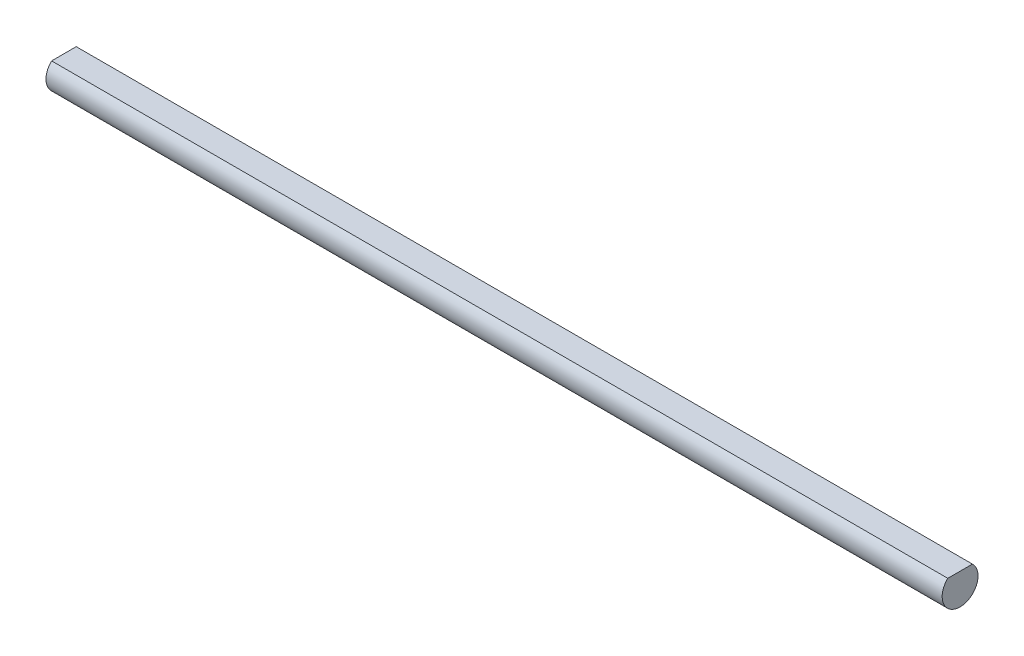
from build123d import *

# Parameters (mm, degrees)
AUFSATZ_LINEAR_AUSTRAGEN1_DEPTH = 100


with BuildPart() as part:
    # Skizze2 → Aufsatz-Linear austragen1 (new, symmetric)
    with BuildSketch(Plane(origin=(0, 0, 0), x_dir=(0, 0, -1), z_dir=(1, 0, 0))):
        with BuildLine():
            Line((-2.75, 2.90473751), (2.75, 2.90473751))
            ThreePointArc((2.75, 2.90473751), (0, -4), (-2.75, 2.90473751))
        make_face()
    extrude(amount=AUFSATZ_LINEAR_AUSTRAGEN1_DEPTH, both=True)


solid = part.part
